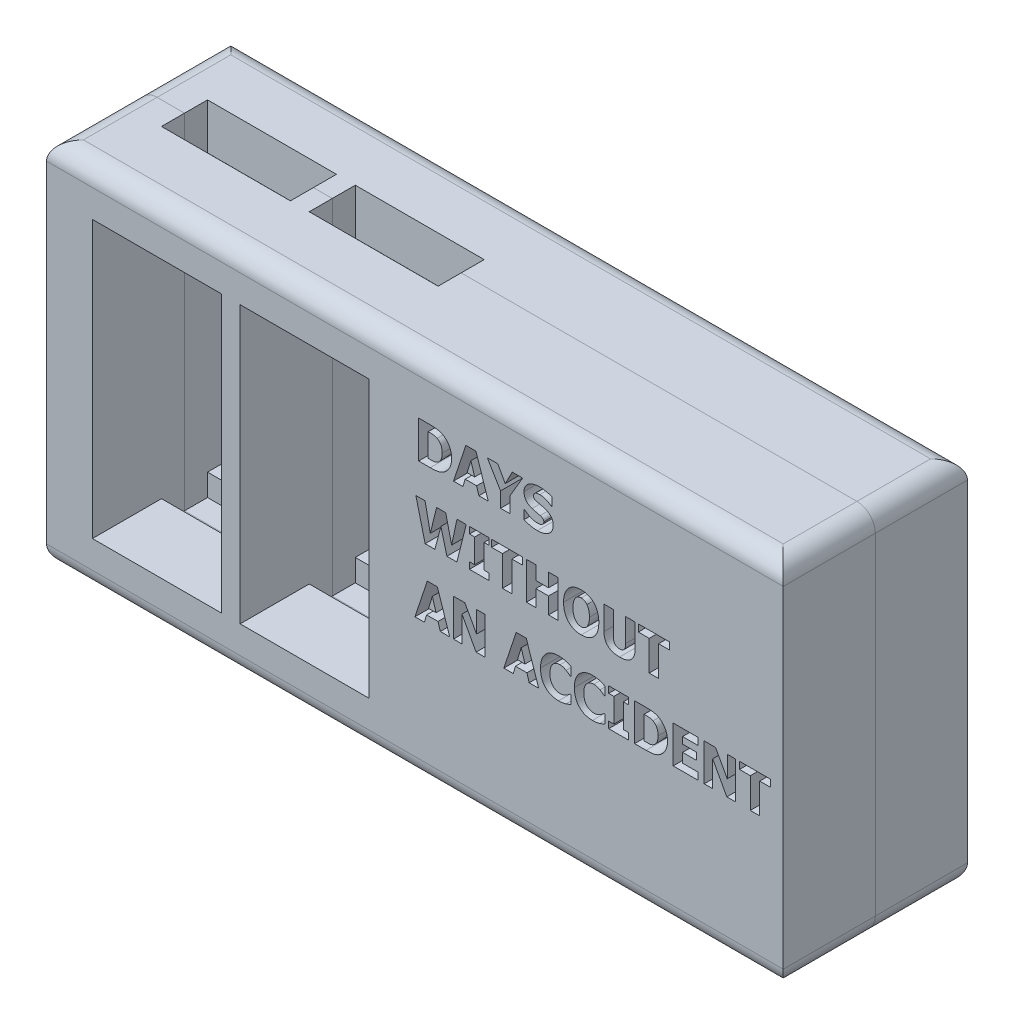
from build123d import *

# Parameters (mm, degrees)
SKETCH1_W           = 101.6
SKETCH1_H           = 25.4
BOSS_EXTRUDE1_DEPTH = 50.8
SKETCH2_W           = 17.78
SKETCH2_H           = 38.122311146
CUT_EXTRUDE1_DEPTH  = 20.32
CUT_EXTRUDE2_DEPTH  = 10.16
SKETCH6_W           = 17.78
SKETCH6_H           = 6.35
CUT_EXTRUDE3_DEPTH  = 47.498
FILLET2_R           = 2.54


with BuildPart() as part:
    # Sketch1 → Boss-Extrude1 (new body)
    with BuildSketch(Plane(origin=(0, 0, 0), x_dir=(1, 0, 0), z_dir=(0, 1, 0))):
        with Locations((50.8, 12.7)):
            Rectangle(SKETCH1_W, SKETCH1_H)
    extrude(amount=BOSS_EXTRUDE1_DEPTH)

    # Sketch2 → Cut-Extrude1 (cut)
    with BuildSketch(Plane.XY):
        with Locations((35.588800345, 25.4)):
            Rectangle(SKETCH2_W, SKETCH2_H)
        with Locations((15.211199655, 25.4)):
            Rectangle(SKETCH2_W, SKETCH2_H)
    extrude(amount=-CUT_EXTRUDE1_DEPTH, mode=Mode.SUBTRACT)

    # Sketch5 → Cut-Extrude2 (cut)
    # profile 1 of 21: a face of its own
    with BuildSketch(Plane.XY):
        with BuildLine():
            add(Edge.make_bspline(
                [(55.860391738, 40.657565776), (55.859345725, 40.598744109), (55.85727471, 40.482282241), (55.842973138, 40.309949524), (55.818894263, 40.142299693), (55.783895751, 39.979636733), (55.740907787, 39.821218318), (55.686432048, 39.667830503), (55.624156845, 39.518382251), (55.550663548, 39.375163668), (55.471388434, 39.237950049), (55.385518889, 39.108714701), (55.295867335, 38.987018748), (55.200186799, 38.873735884), (55.098575435, 38.769831048), (54.993298449, 38.672469793), (54.881272957, 38.585510259), (54.803392021, 38.532773851), (54.764581748, 38.506493807)],
                knots=[0, 0, 0, 0, 1.121822389, 2.221112362, 3.295660391, 4.349819622, 5.392669781, 6.424006338, 7.452176772, 8.478224285, 9.491830202, 10.473124269, 11.435960549, 12.37335562, 13.298531032, 14.206304325, 15.106150719, 16, 16, 16, 16], degree=3))
            add(Edge.make_bspline(
                [(54.764581748, 38.506493807), (54.697836119, 38.465744741), (54.565315216, 38.384839023), (54.352106167, 38.29118759), (54.131329397, 38.21795702), (53.900615274, 38.170871691), (53.663204821, 38.140160661), (53.418806585, 38.116040228), (53.167123373, 38.103450534), (52.996700184, 38.101158826), (52.910523958, 38.1)],
                knots=[0, 0, 0, 0, 0.973457821, 1.932763407, 2.894071884, 3.866837462, 4.861230705, 5.876345917, 6.926152624, 8, 8, 8, 8], degree=3))
            Line((52.910523958, 38.1), (51.319014537, 38.1))
            Line((51.319014537, 38.1), (51.319014537, 43.225268555))
            Line((51.319014537, 43.225268555), (52.896332154, 43.225268555))
            add(Edge.make_bspline(
                [(52.896332154, 43.225268555), (52.984203961, 43.224603014), (53.157346989, 43.22329163), (53.412606964, 43.209561145), (53.65945997, 43.188408476), (53.898526801, 43.159454963), (54.131155329, 43.114021252), (54.3557594, 43.042872359), (54.572733959, 42.945836663), (54.708925914, 42.864127083), (54.777759851, 42.822829548)],
                knots=[0, 0, 0, 0, 1.079902021, 2.127844083, 3.140779136, 4.124649306, 5.086536717, 6.049284413, 7.014072209, 8, 8, 8, 8], degree=3))
            add(Edge.make_bspline(
                [(54.777759851, 42.822829548), (54.818679442, 42.795304384), (54.900332719, 42.740379108), (55.016223353, 42.648609443), (55.12524214, 42.549370197), (55.228273075, 42.443778008), (55.323582335, 42.330581984), (55.413129029, 42.211089199), (55.495077188, 42.083703206), (55.571264007, 41.950384136), (55.63931854, 41.809846098), (55.699147932, 41.663430595), (55.749072639, 41.51024112), (55.78885061, 41.351206312), (55.822219248, 41.186639839), (55.843439916, 41.01548699), (55.858719069, 40.838620107), (55.859829513, 40.718422582), (55.860391738, 40.657565776)],
                knots=[0, 0, 0, 0, 0.935560749, 1.86687108, 2.801970286, 3.731535202, 4.664191023, 5.608042752, 6.563109811, 7.536574956, 8.520207772, 9.523969371, 10.535788198, 11.574633174, 12.633450416, 13.71986561, 14.845552802, 16, 16, 16, 16], degree=3))
        make_face()
        with BuildLine():
            add(Edge.make_bspline(
                [(54.562855395, 40.665675378), (54.560667987, 40.746529388), (54.556449326, 40.902465452), (54.525473489, 41.127832683), (54.470795304, 41.334302466), (54.407143679, 41.493253977), (54.346668983, 41.610610732), (54.294013664, 41.691906032), (54.237323327, 41.769813641), (54.173780115, 41.842310289), (54.103995839, 41.909357357), (54.029950581, 41.973032275), (53.948873696, 42.030517657), (53.891354018, 42.064634328), (53.862388509, 42.081814652)],
                knots=[0, 0, 0, 0, 1.750384853, 3.375814294, 4.912618378, 6.363557404, 7.073665802, 7.767764976, 8.458424072, 9.158359342, 9.851648351, 10.552347909, 11.270997694, 12, 12, 12, 12], degree=3))
            add(Edge.make_bspline(
                [(53.862388509, 42.081814652), (53.819323205, 42.104309224), (53.73404201, 42.148854687), (53.598045149, 42.193987896), (53.460140384, 42.227388187), (53.31653873, 42.239336524), (53.165667085, 42.243985539), (53.002809827, 42.250069027), (52.826049857, 42.251158838), (52.703390485, 42.25178962), (52.639865986, 42.252116297)],
                knots=[0, 0, 0, 0, 0.931672598, 1.844969007, 2.743879701, 3.650511313, 4.605290892, 5.644149072, 6.779919967, 8, 8, 8, 8], degree=3))
            Line((52.639865986, 42.252116297), (52.61655088, 42.252116297))
            Line((52.61655088, 42.252116297), (52.61655088, 39.073152257))
            Line((52.61655088, 39.073152257), (52.639865986, 39.073152257))
            add(Edge.make_bspline(
                [(52.639865986, 39.073152257), (52.708461841, 39.07330186), (52.840254344, 39.07358929), (53.029472883, 39.076996383), (53.201855467, 39.080659675), (53.359921667, 39.086538185), (53.509144073, 39.101759001), (53.651939032, 39.139654255), (53.791803694, 39.194053068), (53.878883468, 39.244926974), (53.923210526, 39.270823809)],
                knots=[0, 0, 0, 0, 1.248445623, 2.398625619, 3.444398636, 4.386318194, 5.278054247, 6.167050445, 7.066956017, 8, 8, 8, 8], degree=3))
            add(Edge.make_bspline(
                [(53.923210526, 39.270823809), (53.973322451, 39.305573418), (54.072987657, 39.37468525), (54.202806101, 39.50356559), (54.312802424, 39.651256875), (54.40514012, 39.816910269), (54.475762707, 40.002811475), (54.52703119, 40.206859625), (54.557611437, 40.430253304), (54.561061843, 40.58515572), (54.562855395, 40.665675378)],
                knots=[0, 0, 0, 0, 0.910460996, 1.810772236, 2.720195286, 3.656503622, 4.636985059, 5.684687075, 6.796479684, 8, 8, 8, 8], degree=3))
        make_face(mode=Mode.SUBTRACT)
    # profile 2 of 21: a face of its own
    with BuildSketch(Plane.XY):
        Polygon((56.119899006, 38.1), (57.827983958, 43.225268555), (59.212698524, 43.225268555), (60.920783475, 38.1), (59.621219732, 38.1), (59.306972649, 39.138029074), (57.732696132, 39.138029074), (57.418449049, 38.1), align=None)
        Polygon((59.038342078, 40.046304514), (58.520341241, 41.742225063), (58.001326703, 40.046304514), align=None, mode=Mode.SUBTRACT)
    # profile 3 of 21: a face of its own
    with BuildSketch(Plane.XY):
        Polygon((65.656791127, 43.225268555), (63.905117064, 40.240934966), (63.905117064, 38.1), (62.607580721, 38.1), (62.607580721, 40.176058149), (60.791029841, 43.225268555), (62.22541572, 43.225268555), (63.254321492, 41.370197064), (64.227473749, 43.225268555), align=None)
    # profile 4 of 21: a face of its own
    with BuildSketch(Plane.XY):
        with BuildLine():
            add(Edge.make_bspline(
                [(67.684191663, 37.970246366), (67.59054776, 37.971502078), (67.409085814, 37.973935381), (67.14540111, 37.995696111), (66.89903776, 38.030111778), (66.668797548, 38.080798934), (66.452167685, 38.142459728), (66.244597442, 38.211183875), (66.043987762, 38.283707112), (65.915011853, 38.339907724), (65.851421578, 38.367616871)],
                knots=[0, 0, 0, 0, 1.188587951, 2.303230391, 3.356350567, 4.344124042, 5.293358606, 6.214416522, 7.119636025, 8, 8, 8, 8], degree=3))
            Line((65.851421578, 38.367616871), (65.851421578, 39.592166794))
            Line((65.851421578, 39.592166794), (65.966983409, 39.592166794))
            add(Edge.make_bspline(
                [(65.966983409, 39.592166794), (66.030896075, 39.536884364), (66.157448673, 39.427420376), (66.363116152, 39.285530078), (66.577127839, 39.162124289), (66.799689594, 39.060502134), (67.02469621, 38.979142217), (67.249333672, 38.922988044), (67.469995479, 38.884560651), (67.616794402, 38.880517611), (67.689260164, 38.878521806)],
                knots=[0, 0, 0, 0, 1.064005933, 2.106823643, 3.142324773, 4.172904671, 5.185521809, 6.151983196, 7.087745727, 8, 8, 8, 8], degree=3))
            add(Edge.make_bspline(
                [(67.689260164, 38.878521806), (67.70886662, 38.879028328), (67.750834511, 38.880112545), (67.818101991, 38.885594644), (67.893799737, 38.893797557), (67.975756451, 38.904283271), (68.057717935, 38.918781274), (68.134070195, 38.936687799), (68.201638954, 38.958310733), (68.241906926, 38.977768197), (68.260987115, 38.986987734)],
                knots=[0, 0, 0, 0, 0.803171281, 1.719199296, 2.763054104, 3.921781135, 5.102693432, 6.170135007, 7.132954358, 8, 8, 8, 8], degree=3))
            add(Edge.make_bspline(
                [(68.260987115, 38.986987734), (68.282541357, 38.998354748), (68.325338429, 39.020924546), (68.384402068, 39.062646056), (68.437264423, 39.111393454), (68.487038985, 39.164176328), (68.52690821, 39.227285846), (68.557126391, 39.298934921), (68.572502157, 39.380682193), (68.574962395, 39.437692898), (68.576247899, 39.467481661)],
                knots=[0, 0, 0, 0, 0.958250464, 1.902656275, 2.834625234, 3.785374419, 4.748042504, 5.755488648, 6.827216455, 8, 8, 8, 8], degree=3))
            add(Edge.make_bspline(
                [(68.576247899, 39.467481661), (68.57468767, 39.498794905), (68.571648963, 39.559780681), (68.542166648, 39.64635747), (68.492519062, 39.722296965), (68.425839409, 39.787849628), (68.346308734, 39.84255387), (68.261128571, 39.894150953), (68.166132506, 39.932528682), (68.099959438, 39.952857892), (68.066356664, 39.963181092)],
                knots=[0, 0, 0, 0, 0.976980105, 1.90276968, 2.820378867, 3.79191295, 4.806747273, 5.83454199, 6.900377446, 8, 8, 8, 8], degree=3))
            add(Edge.make_bspline(
                [(68.066356664, 39.963181092), (67.9766104, 39.986403836), (67.791936009, 40.034190183), (67.509677135, 40.095331473), (67.227626297, 40.160432706), (67.045866269, 40.220028022), (66.957368571, 40.249044568)],
                knots=[0, 0, 0, 0, 0.970778871, 1.997609583, 3.025049981, 4, 4, 4, 4], degree=3))
            add(Edge.make_bspline(
                [(66.957368571, 40.249044568), (66.909502053, 40.267083309), (66.816484266, 40.302137534), (66.683870133, 40.362567126), (66.56162407, 40.426592963), (66.449979234, 40.496302196), (66.348720845, 40.569797932), (66.257563153, 40.648231795), (66.177497314, 40.731643396), (66.1061999, 40.819174783), (66.046992461, 40.913703141), (65.99346106, 41.011680152), (65.950063995, 41.116603183), (65.913214393, 41.22649693), (65.88656478, 41.342770892), (65.86592807, 41.463870827), (65.853652266, 41.590930929), (65.852175663, 41.67765965), (65.851421578, 41.721951057)],
                knots=[0, 0, 0, 0, 1.232734205, 2.395541005, 3.510463934, 4.556875624, 5.565319495, 6.523880384, 7.451310254, 8.349375782, 9.239576409, 10.136015274, 11.0376197, 11.972601359, 12.926826808, 13.909683999, 14.932498543, 16, 16, 16, 16], degree=3))
            add(Edge.make_bspline(
                [(65.851421578, 41.721951057), (65.853034471, 41.781200126), (65.856205948, 41.89770328), (65.885441389, 42.068264485), (65.933147203, 42.230191041), (65.999284318, 42.383744733), (66.085592239, 42.527880382), (66.190658796, 42.663079042), (66.314632882, 42.789689441), (66.456217232, 42.905990789), (66.611187539, 43.012296493), (66.778360182, 43.102866419), (66.953516353, 43.181872005), (67.138386421, 43.245771932), (67.333288162, 43.29400136), (67.536842876, 43.32933193), (67.749944571, 43.351175438), (67.894988544, 43.353722019), (67.969041438, 43.355022189)],
                knots=[0, 0, 0, 0, 0.951733787, 1.8714216, 2.771937187, 3.659834458, 4.551246461, 5.464900409, 6.405895824, 7.393377429, 8.405714223, 9.421759516, 10.445282372, 11.49132611, 12.560961497, 13.669079994, 14.809937645, 16, 16, 16, 16], degree=3))
            add(Edge.make_bspline(
                [(67.969041438, 43.355022189), (68.044763799, 43.353779291), (68.196399049, 43.351290368), (68.423057715, 43.333416424), (68.649160313, 43.305407159), (68.872214656, 43.264530366), (69.089811929, 43.215592729), (69.297563088, 43.157876457), (69.493901125, 43.092823133), (69.618285013, 43.040860936), (69.67915379, 43.015432599)],
                knots=[0, 0, 0, 0, 1.035526462, 2.073658467, 3.107699001, 4.15013179, 5.173679131, 6.156969703, 7.09809057, 8, 8, 8, 8], degree=3))
            Line((69.67915379, 43.015432599), (69.67915379, 41.862855395))
            Line((69.67915379, 41.862855395), (69.56561936, 41.862855395))
            add(Edge.make_bspline(
                [(69.56561936, 41.862855395), (69.516310568, 41.903000296), (69.415653887, 41.984950236), (69.248074109, 42.092305806), (69.066191102, 42.192301178), (68.870636484, 42.280013553), (68.666350798, 42.355093539), (68.455877881, 42.406827649), (68.242878274, 42.44153774), (68.099606988, 42.445008228), (68.027836054, 42.446746749)],
                knots=[0, 0, 0, 0, 0.909132475, 1.855860894, 2.842486714, 3.876811078, 4.919788485, 5.951669293, 6.973900401, 8, 8, 8, 8], degree=3))
            add(Edge.make_bspline(
                [(68.027836054, 42.446746749), (67.974718277, 42.445834927), (67.873453636, 42.444096614), (67.725854114, 42.423685645), (67.582629705, 42.383844296), (67.491732574, 42.342021799), (67.443944699, 42.320034215)],
                knots=[0, 0, 0, 0, 1.055808145, 2.01281076, 2.955263502, 4, 4, 4, 4], degree=3))
            add(Edge.make_bspline(
                [(67.443944699, 42.320034215), (67.424379206, 42.309369511), (67.385088755, 42.287953182), (67.330835715, 42.246353207), (67.280581218, 42.198007), (67.234904188, 42.143307491), (67.195911453, 42.083755596), (67.169997699, 42.018065162), (67.151184975, 41.950070559), (67.149704012, 41.902859134), (67.148957921, 41.879074599)],
                knots=[0, 0, 0, 0, 0.957416142, 1.922635494, 2.930164298, 3.951958416, 4.984347753, 5.975062963, 6.979861616, 8, 8, 8, 8], degree=3))
            add(Edge.make_bspline(
                [(67.148957921, 41.879074599), (67.150742683, 41.847483129), (67.154183248, 41.78658284), (67.179836876, 41.699770186), (67.22489127, 41.624119256), (67.276252711, 41.569859668), (67.327857434, 41.532601693), (67.374519585, 41.504260071), (67.429762588, 41.476749222), (67.493308005, 41.451517756), (67.563853034, 41.424233884), (67.64286109, 41.399424717), (67.730208433, 41.37524205), (67.791270746, 41.359926136), (67.823068599, 41.35195046)],
                knots=[0, 0, 0, 0, 1.214264784, 2.34079248, 3.441844924, 4.572488008, 5.185916398, 5.885766898, 6.670379076, 7.556104553, 8.514370256, 9.57884454, 10.739196989, 12, 12, 12, 12], degree=3))
            add(Edge.make_bspline(
                [(67.823068599, 41.35195046), (67.907238189, 41.332818851), (68.072368717, 41.295284955), (68.319821497, 41.236679411), (68.572082213, 41.171984994), (68.739508807, 41.113666719), (68.826631865, 41.083319889)],
                knots=[0, 0, 0, 0, 0.996266869, 1.954554799, 2.935620461, 4, 4, 4, 4], degree=3))
            add(Edge.make_bspline(
                [(68.826631865, 41.083319889), (68.869801356, 41.067030874), (68.954147799, 41.035204683), (69.07352396, 40.978361206), (69.18579671, 40.92050992), (69.288325083, 40.85605421), (69.38292145, 40.788167084), (69.46941588, 40.716436717), (69.546737415, 40.639845242), (69.616681211, 40.559397958), (69.6775869, 40.472696075), (69.730803427, 40.380314097), (69.774191795, 40.280734381), (69.810992827, 40.175126242), (69.839058691, 40.062437109), (69.85925688, 39.943163708), (69.871569402, 39.817467636), (69.873035441, 39.731409879), (69.873784241, 39.68745462)],
                knots=[0, 0, 0, 0, 1.17454689, 2.294881178, 3.365011102, 4.38938974, 5.375760562, 6.328835541, 7.247690706, 8.144686596, 9.040029798, 9.941965584, 10.855040075, 11.802113214, 12.787244475, 13.808691087, 14.880756899, 16, 16, 16, 16], degree=3))
            add(Edge.make_bspline(
                [(69.873784241, 39.68745462), (69.872086765, 39.624506547), (69.868757172, 39.50103416), (69.840935545, 39.32036329), (69.79434322, 39.149277431), (69.728949697, 38.987646423), (69.645114373, 38.835655959), (69.543312277, 38.692578244), (69.421232531, 38.56048742), (69.282600174, 38.438300027), (69.128740862, 38.327703998), (68.960234773, 38.232266155), (68.779177827, 38.15133424), (68.585356544, 38.083867415), (68.3782859, 38.032670861), (68.158258493, 37.996787461), (67.925605133, 37.973756341), (67.766020071, 37.971436091), (67.684191663, 37.970246366)],
                knots=[0, 0, 0, 0, 0.965575501, 1.893972421, 2.797150248, 3.681070906, 4.56293602, 5.455031491, 6.368877871, 7.316649527, 8.286503653, 9.271159268, 10.283057314, 11.32599161, 12.416327018, 13.55177918, 14.744656859, 16, 16, 16, 16], degree=3))
        make_face()
    # profile 5 of 21: a face of its own
    with BuildSketch(Plane.XY):
        Polygon((57.871573069, 33.791282325), (56.592283331, 28.666013771), (55.210609866, 28.666013771), (54.388498948, 31.835854509), (53.554223628, 28.666013771), (52.209043372, 28.666013771), (50.929753634, 33.791282325), (52.20093377, 33.791282325), (52.91964726, 30.260564292), (53.791429491, 33.791282325), (55.050445223, 33.791282325), (55.861405438, 30.324427409), (56.600392933, 33.791282325), align=None)
    # profile 6 of 21: a face of its own
    with BuildSketch(Plane.XY):
        Polygon((61.050537109, 28.666013771), (58.325710789, 28.666013771), (58.325710789, 29.574289211), (59.039355778, 29.574289211), (59.039355778, 32.883006885), (58.325710789, 32.883006885), (58.325710789, 33.791282325), (61.050537109, 33.791282325), (61.050537109, 32.883006885), (60.336892121, 32.883006885), (60.336892121, 29.574289211), (61.050537109, 29.574289211), align=None)
    # profile 7 of 21: a face of its own
    with BuildSketch(Plane.XY):
        Polygon((62.86708799, 28.666013771), (62.86708799, 32.818130068), (61.374921195, 32.818130068), (61.374921195, 33.791282325), (65.656791127, 33.791282325), (65.656791127, 32.818130068), (64.164624332, 32.818130068), (64.164624332, 28.666013771), align=None)
    # profile 8 of 21: a face of its own
    with BuildSketch(Plane.XY):
        Polygon((70.522552413, 28.666013771), (69.22501607, 28.666013771), (69.22501607, 30.936702371), (67.473342007, 30.936702371), (67.473342007, 28.666013771), (66.175805664, 28.666013771), (66.175805664, 33.791282325), (67.473342007, 33.791282325), (67.473342007, 31.909854628), (69.22501607, 31.909854628), (69.22501607, 33.791282325), (70.522552413, 33.791282325), align=None)
    # profile 9 of 21: a face of its own
    with BuildSketch(Plane.XY):
        with BuildLine():
            add(Edge.make_bspline(
                [(76.166835505, 31.226620648), (76.165002478, 31.124832695), (76.161431286, 30.926524522), (76.13041728, 30.637409597), (76.080344608, 30.365060208), (76.009762219, 30.108841718), (75.916787832, 29.869916096), (75.805797542, 29.646165518), (75.671946454, 29.440773417), (75.519811686, 29.252494514), (75.349557709, 29.084057785), (75.163054107, 28.937376229), (74.961682446, 28.812404167), (74.744924412, 28.710861452), (74.512441368, 28.63283197), (74.265700227, 28.576164904), (74.003525586, 28.542316156), (73.823937473, 28.53831175), (73.731927461, 28.536260136)],
                knots=[0, 0, 0, 0, 1.189079844, 2.316622391, 3.39301205, 4.421840737, 5.416816174, 6.384428204, 7.335006513, 8.275362366, 9.207852477, 10.127253029, 11.042132357, 11.971180715, 12.917592702, 13.902165424, 14.925197332, 16, 16, 16, 16], degree=3))
            add(Edge.make_bspline(
                [(73.731927461, 28.536260136), (73.639560724, 28.538170012), (73.459554164, 28.541892023), (73.197252304, 28.577588402), (72.950196958, 28.633511864), (72.717879222, 28.712983998), (72.501125652, 28.815473451), (72.299494461, 28.941453071), (72.11323051, 29.089903645), (71.944144116, 29.261091986), (71.7917681, 29.450128697), (71.660825326, 29.657845294), (71.548629839, 29.880249733), (71.458752073, 30.119465106), (71.387498611, 30.373783684), (71.337608252, 30.644181618), (71.306487533, 30.930228502), (71.30290864, 31.126181616), (71.301074219, 31.226620648)],
                knots=[0, 0, 0, 0, 1.080317887, 2.105349957, 3.091355781, 4.040422853, 4.97251073, 5.890809664, 6.816459549, 7.753090285, 8.700970549, 9.651987685, 10.62100813, 11.610906846, 12.637424941, 13.707608467, 14.824996543, 16, 16, 16, 16], degree=3))
            add(Edge.make_bspline(
                [(71.301074219, 31.226620648), (71.302930239, 31.327732555), (71.306557986, 31.525364241), (71.337434866, 31.813465544), (71.387509327, 32.085529422), (71.458770057, 32.340850554), (71.548449335, 32.580820279), (71.660530083, 32.803365018), (71.792138644, 33.010297737), (71.943810522, 33.199212943), (72.113269013, 33.369474348), (72.299799469, 33.51679156), (72.501086496, 33.642905616), (72.717908564, 33.745225473), (72.950045569, 33.825115823), (73.197411166, 33.879351774), (73.459531429, 33.915502971), (73.639553014, 33.919159623), (73.731927461, 33.92103596)],
                knots=[0, 0, 0, 0, 1.181311189, 2.308971597, 3.381592327, 4.410528555, 5.402783556, 6.37049673, 7.316900563, 8.263502075, 9.196072939, 10.118016634, 11.035076724, 11.965907153, 12.913693872, 13.897490296, 14.921139532, 16, 16, 16, 16], degree=3))
            add(Edge.make_bspline(
                [(73.731927461, 33.92103596), (73.823940511, 33.918993201), (74.003534554, 33.915006079), (74.265666887, 33.881034025), (74.512666011, 33.824783821), (74.744710835, 33.745137185), (74.961721086, 33.643973859), (75.163011622, 33.518845997), (75.349878319, 33.372224595), (75.519827533, 33.202716762), (75.671665203, 33.013602064), (75.805835309, 32.808116907), (75.916776911, 32.584331229), (76.009766913, 32.345415594), (76.080336854, 32.08919349), (76.130506032, 31.816517528), (76.16137807, 31.527048183), (76.164986498, 31.328407006), (76.166835505, 31.226620648)],
                knots=[0, 0, 0, 0, 1.074060791, 2.096386557, 3.080279682, 4.027313204, 4.955720291, 5.869968128, 6.788734069, 7.723357901, 8.666132665, 9.616054842, 10.582998983, 11.577287643, 12.605406185, 13.681052873, 14.811740912, 16, 16, 16, 16], degree=3))
        make_face()
        with BuildLine():
            add(Edge.make_bspline(
                [(74.869299162, 31.230675449), (74.868137017, 31.305047234), (74.865904439, 31.447921768), (74.848832587, 31.653869983), (74.819976427, 31.842297385), (74.779470679, 32.014158777), (74.728266019, 32.169627693), (74.670778328, 32.31122873), (74.605960029, 32.43913669), (74.553203158, 32.514884237), (74.527682172, 32.551526898)],
                knots=[0, 0, 0, 0, 1.287174704, 2.472772232, 3.57375833, 4.583793058, 5.525202796, 6.403859325, 7.227871477, 8, 8, 8, 8], degree=3))
            add(Edge.make_bspline(
                [(74.527682172, 32.551526898), (74.500261902, 32.584844931), (74.447015543, 32.64954393), (74.358605903, 32.735387442), (74.262365121, 32.803075665), (74.162298296, 32.857520178), (74.058533145, 32.897941973), (73.952724414, 32.926111931), (73.84506961, 32.944291101), (73.772547454, 32.946679492), (73.735982262, 32.947883703)],
                knots=[0, 0, 0, 0, 1.126585517, 2.187672819, 3.206336016, 4.189521334, 5.156373335, 6.106816172, 7.045469219, 8, 8, 8, 8], degree=3))
            add(Edge.make_bspline(
                [(73.735982262, 32.947883703), (73.697731047, 32.947066467), (73.622892751, 32.94546755), (73.513618443, 32.928326881), (73.409667419, 32.902624737), (73.310607309, 32.864216568), (73.214370995, 32.813496637), (73.123076149, 32.743106362), (73.030893737, 32.659660324), (72.975907572, 32.593181358), (72.947323454, 32.5586228)],
                knots=[0, 0, 0, 0, 1.002961705, 1.962289189, 2.895653215, 3.80792997, 4.744195718, 5.739089679, 6.824683862, 8, 8, 8, 8], degree=3))
            add(Edge.make_bspline(
                [(72.947323454, 32.5586228), (72.921821643, 32.522651536), (72.868839526, 32.447918269), (72.803016372, 32.32071234), (72.74276523, 32.178216665), (72.69203674, 32.018986785), (72.648292736, 31.843935367), (72.620697785, 31.652055169), (72.601624842, 31.444613939), (72.59963914, 31.301007649), (72.598610562, 31.226620648)],
                knots=[0, 0, 0, 0, 0.755164283, 1.568916089, 2.449019537, 3.40530965, 4.430988336, 5.538686369, 6.72505765, 8, 8, 8, 8], degree=3))
            add(Edge.make_bspline(
                [(72.598610562, 31.226620648), (72.599741332, 31.150556407), (72.601905529, 31.00497602), (72.619142636, 30.796742922), (72.646651004, 30.60855012), (72.686413541, 30.439434105), (72.736312717, 30.286917144), (72.795587525, 30.148547695), (72.86141501, 30.021783126), (72.914412433, 29.94581465), (72.940227552, 29.908810299)],
                knots=[0, 0, 0, 0, 1.318170318, 2.522864159, 3.618647017, 4.611587825, 5.530173897, 6.396057923, 7.218717585, 8, 8, 8, 8], degree=3))
            add(Edge.make_bspline(
                [(72.940227552, 29.908810299), (72.967584267, 29.875090175), (73.02085561, 29.809427456), (73.110314522, 29.723392931), (73.206386746, 29.653788129), (73.307724369, 29.599836877), (73.412132383, 29.55952316), (73.518537443, 29.531031869), (73.626572505, 29.513088106), (73.699420857, 29.510640705), (73.735982262, 29.509412394)],
                knots=[0, 0, 0, 0, 1.126399206, 2.193421182, 3.21099292, 4.195910863, 5.165042014, 6.109693258, 7.051285721, 8, 8, 8, 8], degree=3))
            add(Edge.make_bspline(
                [(73.735982262, 29.509412394), (73.772877878, 29.510617432), (73.846778855, 29.513031093), (73.95683787, 29.531560815), (74.064457425, 29.563869129), (74.170706721, 29.605686737), (74.271840446, 29.662734719), (74.367050937, 29.732967223), (74.453880906, 29.818278053), (74.504724101, 29.882874281), (74.530723272, 29.915906201)],
                knots=[0, 0, 0, 0, 0.954659109, 1.912157864, 2.877967119, 3.858822935, 4.861119912, 5.873816251, 6.912754912, 8, 8, 8, 8], degree=3))
            add(Edge.make_bspline(
                [(74.530723272, 29.915906201), (74.556764806, 29.954673041), (74.609709803, 30.033489836), (74.676944635, 30.16126315), (74.735012893, 30.298308357), (74.784619147, 30.446467071), (74.82364804, 30.611551239), (74.849505896, 30.79749973), (74.867455615, 31.006298373), (74.86866303, 31.153252123), (74.869299162, 31.230675449)],
                knots=[0, 0, 0, 0, 0.811098523, 1.649043018, 2.504094341, 3.39537459, 4.360999606, 5.44717599, 6.655031781, 8, 8, 8, 8], degree=3))
        make_face(mode=Mode.SUBTRACT)
    # profile 10 of 21: a face of its own
    with BuildSketch(Plane.XY):
        with BuildLine():
            add(Edge.make_bspline(
                [(79.019388059, 28.536260136), (78.935864713, 28.537780283), (78.773547029, 28.540734508), (78.537798069, 28.564596702), (78.316356432, 28.601884495), (78.110510821, 28.65837344), (77.91836874, 28.727432613), (77.742030574, 28.814479164), (77.579558671, 28.915746503), (77.432930871, 29.033907069), (77.302543786, 29.167243039), (77.188868701, 29.315454805), (77.093741919, 29.478573374), (77.014939053, 29.655583155), (76.954387465, 29.847430994), (76.911108941, 30.053501133), (76.885850343, 30.274129709), (76.882306604, 30.425731172), (76.880480493, 30.503852357)],
                knots=[0, 0, 0, 0, 1.20889921, 2.349351777, 3.427017415, 4.455847307, 5.435483287, 6.378388974, 7.297220547, 8.201760428, 9.097701332, 9.990980776, 10.898742395, 11.825056972, 12.790409071, 13.805470659, 14.869145272, 16, 16, 16, 16], degree=3))
            Line((76.880480493, 30.503852357), (76.880480493, 33.791282325))
            Line((76.880480493, 33.791282325), (78.178016836, 33.791282325))
            Line((78.178016836, 33.791282325), (78.178016836, 30.572783975))
            add(Edge.make_bspline(
                [(78.178016836, 30.572783975), (78.178546713, 30.529512177), (78.179574606, 30.445570302), (78.18901724, 30.323776174), (78.203131246, 30.210417546), (78.226533098, 30.106128612), (78.252505387, 30.009535964), (78.287892444, 29.922206725), (78.326573011, 29.84216626), (78.373948212, 29.771543157), (78.42760669, 29.708987792), (78.48983486, 29.655686826), (78.558619267, 29.609670696), (78.636152809, 29.573404493), (78.720481472, 29.543438991), (78.813551957, 29.523909088), (78.913963564, 29.511532242), (78.983530963, 29.510133399), (79.019388059, 29.509412394)],
                knots=[0, 0, 0, 0, 1.331165497, 2.582294552, 3.757141455, 4.84200943, 5.868829169, 6.830301252, 7.736977925, 8.599166662, 9.439321676, 10.264810001, 11.11258577, 11.97752831, 12.891625934, 13.860322391, 14.897146833, 16, 16, 16, 16], degree=3))
            add(Edge.make_bspline(
                [(79.019388059, 29.509412394), (79.054572106, 29.510111475), (79.122797776, 29.511467068), (79.221422375, 29.524156056), (79.313238803, 29.542869526), (79.397745097, 29.570035232), (79.474676694, 29.605837606), (79.544325668, 29.649630659), (79.606312024, 29.701830558), (79.662170059, 29.761225916), (79.710133044, 29.830416539), (79.751462537, 29.908872411), (79.786793908, 29.996571555), (79.816362624, 30.093476893), (79.83836289, 30.20005551), (79.852628015, 30.316029714), (79.863640159, 30.441133692), (79.864413101, 30.527815725), (79.864814082, 30.572783975)],
                knots=[0, 0, 0, 0, 1.079206003, 2.092697049, 3.046504859, 3.951550563, 4.809764005, 5.644026712, 6.468501297, 7.290232633, 8.138870875, 9.04344124, 10.006225207, 11.036185737, 12.148605823, 13.340896587, 14.620530438, 16, 16, 16, 16], degree=3))
            Line((79.864814082, 30.572783975), (79.864814082, 33.791282325))
            Line((79.864814082, 33.791282325), (81.162350425, 33.791282325))
            Line((81.162350425, 33.791282325), (81.162350425, 30.506893457))
            add(Edge.make_bspline(
                [(81.162350425, 30.506893457), (81.160953033, 30.42978216), (81.158235945, 30.279847081), (81.13263341, 30.061998597), (81.089954822, 29.858194221), (81.031878389, 29.667055276), (80.954320372, 29.490765576), (80.861817188, 29.32704651), (80.750194288, 29.178748897), (80.623292798, 29.043156659), (80.479374039, 28.922356313), (80.317869887, 28.819435232), (80.141714395, 28.730207383), (79.948131779, 28.659759952), (79.738726567, 28.604414013), (79.513365356, 28.563878706), (79.271604413, 28.540878772), (79.105263862, 28.537832711), (79.019388059, 28.536260136)],
                knots=[0, 0, 0, 0, 1.112985887, 2.164087931, 3.161073054, 4.116228462, 5.042529852, 5.936270584, 6.825138138, 7.715570683, 8.612541069, 9.530013209, 10.474708362, 11.457956063, 12.498132776, 13.598602899, 14.760242755, 16, 16, 16, 16], degree=3))
        make_face()
    # profile 11 of 21: a face of its own
    with BuildSketch(Plane.XY):
        Polygon((83.10865494, 28.666013771), (83.10865494, 32.818130068), (81.616488145, 32.818130068), (81.616488145, 33.791282325), (85.898358077, 33.791282325), (85.898358077, 32.818130068), (84.406191283, 32.818130068), (84.406191283, 28.666013771), align=None)
    # profile 12 of 21: a face of its own
    with BuildSketch(Plane.XY):
        Polygon((50.8, 19.232027542), (52.508084951, 24.357296096), (53.892799517, 24.357296096), (55.600884469, 19.232027542), (54.301320725, 19.232027542), (53.987073642, 20.270056616), (52.412797126, 20.270056616), (52.098550043, 19.232027542), align=None)
        Polygon((53.718443071, 21.178332056), (53.200442234, 22.874252604), (52.681427697, 21.178332056), align=None, mode=Mode.SUBTRACT)
    # profile 13 of 21: a face of its own
    with BuildSketch(Plane.XY):
        Polygon((60.466645755, 19.232027542), (59.23804103, 19.232027542), (57.287681715, 22.805320986), (57.287681715, 19.232027542), (56.119899006, 19.232027542), (56.119899006, 24.357296096), (57.68505222, 24.357296096), (59.298863046, 21.42162012), (59.298863046, 24.357296096), (60.466645755, 24.357296096), align=None)
    # profile 14 of 21: a face of its own
    with BuildSketch(Plane.XY):
        Polygon((63.061718441, 19.232027542), (64.769803392, 24.357296096), (66.154517958, 24.357296096), (67.86260291, 19.232027542), (66.563039166, 19.232027542), (66.248792083, 20.270056616), (64.674515567, 20.270056616), (64.360268484, 19.232027542), align=None)
        Polygon((65.980161512, 21.178332056), (65.462160675, 22.874252604), (64.943146138, 21.178332056), align=None, mode=Mode.SUBTRACT)
    # profile 15 of 21: a face of its own
    with BuildSketch(Plane.XY):
        with BuildLine():
            add(Edge.make_bspline(
                [(70.613785437, 19.102273907), (70.520774133, 19.104439536), (70.338896698, 19.108674279), (70.073325794, 19.141022298), (69.822887219, 19.196881539), (69.58720108, 19.274187084), (69.365313582, 19.372458715), (69.159033165, 19.494966962), (68.966892979, 19.638606667), (68.791522875, 19.804565235), (68.63300527, 19.989359193), (68.496802165, 20.194658876), (68.379049571, 20.416145508), (68.285780111, 20.65716356), (68.21074444, 20.914738992), (68.160989361, 21.191018891), (68.126846284, 21.484291246), (68.123715796, 21.686090895), (68.122110179, 21.789593318)],
                knots=[0, 0, 0, 0, 1.074819738, 2.101738696, 3.086164081, 4.035861867, 4.9641276, 5.885061211, 6.802809627, 7.73107536, 8.670179168, 9.610346125, 10.572900667, 11.563534563, 12.59188571, 13.668803488, 14.804336451, 16, 16, 16, 16], degree=3))
            add(Edge.make_bspline(
                [(68.122110179, 21.789593318), (68.123765597, 21.889712076), (68.1270018, 22.085435773), (68.160725517, 22.370763236), (68.212442774, 22.640970247), (68.286995547, 22.89528447), (68.380499073, 23.135135297), (68.498367913, 23.358005469), (68.635309264, 23.566215722), (68.793631849, 23.756694338), (68.969765707, 23.927856516), (69.161549096, 24.078085529), (69.367949574, 24.20565859), (69.589891655, 24.308100874), (69.825657327, 24.388618603), (70.076285876, 24.446106447), (70.341789648, 24.481223914), (70.5237938, 24.485079116), (70.616826538, 24.487049731)],
                knots=[0, 0, 0, 0, 1.157890448, 2.263577786, 3.319369359, 4.337575634, 5.325651106, 6.292712604, 7.249085993, 8.204171971, 9.152488504, 10.085498645, 11.017533542, 11.953299998, 12.907761637, 13.894993682, 14.924010797, 16, 16, 16, 16], degree=3))
            add(Edge.make_bspline(
                [(70.616826538, 24.487049731), (70.66616487, 24.486653119), (70.762515327, 24.485878596), (70.903204516, 24.480080196), (71.036081838, 24.468890861), (71.201667278, 24.448412661), (71.399411381, 24.415783422), (71.553032345, 24.37724298), (71.628499405, 24.358309796)],
                knots=[0, 0, 0, 0, 0.868198881, 1.695463873, 2.477132392, 3.213909951, 4.631319466, 6, 6, 6, 6], degree=3))
            add(Edge.make_bspline(
                [(71.628499405, 24.358309796), (71.689632995, 24.339251257), (71.818248549, 24.299155057), (71.9754571, 24.233799298), (72.102060252, 24.178246451), (72.190045925, 24.138983816), (72.268203555, 24.102668684), (72.316510074, 24.07862376), (72.339103293, 24.06737782)],
                knots=[0, 0, 0, 0, 1.498738303, 3.153111991, 3.982188687, 4.736543176, 5.409074417, 6, 6, 6, 6], degree=3))
            Line((72.339103293, 24.06737782), (72.339103293, 22.865129302))
            Line((72.339103293, 22.865129302), (72.208335959, 22.865129302))
            add(Edge.make_bspline(
                [(72.208335959, 22.865129302), (72.173311122, 22.893997486), (72.096296168, 22.957474778), (71.969073103, 23.056639151), (71.821393662, 23.164485754), (71.711196269, 23.230282186), (71.653841912, 23.264527207)],
                knots=[0, 0, 0, 0, 0.795981873, 1.750258162, 2.829078504, 4, 4, 4, 4], degree=3))
            add(Edge.make_bspline(
                [(71.653841912, 23.264527207), (71.59200571, 23.298074215), (71.465123225, 23.366909745), (71.294270954, 23.430708191), (71.15143344, 23.475560236), (71.039462537, 23.496624841), (70.925766868, 23.51219487), (70.84901959, 23.513327944), (70.810443289, 23.513897473)],
                knots=[0, 0, 0, 0, 1.421940968, 2.917698665, 3.681312824, 4.448317243, 5.220061178, 6, 6, 6, 6], degree=3))
            add(Edge.make_bspline(
                [(70.810443289, 23.513897473), (70.764760748, 23.513161279), (70.675078751, 23.511716013), (70.543939017, 23.493328805), (70.418099804, 23.466615597), (70.297627944, 23.426867282), (70.181462672, 23.373521074), (70.06882333, 23.304588218), (69.958970217, 23.219226841), (69.891345164, 23.152085579), (69.856551337, 23.117540669)],
                knots=[0, 0, 0, 0, 1.028860978, 2.019815538, 2.978883687, 3.925380634, 4.872735138, 5.853659149, 6.895684257, 8, 8, 8, 8], degree=3))
            add(Edge.make_bspline(
                [(69.856551337, 23.117540669), (69.824867247, 23.082470045), (69.759656502, 23.010289292), (69.676882791, 22.883519124), (69.603524192, 22.73969127), (69.53702239, 22.579966321), (69.484985318, 22.402901876), (69.446290213, 22.21068082), (69.424512264, 22.002969466), (69.421303631, 21.85958823), (69.419646521, 21.785538516)],
                knots=[0, 0, 0, 0, 0.789356151, 1.624616758, 2.521741614, 3.487072218, 4.513177191, 5.602442156, 6.761773332, 8, 8, 8, 8], degree=3))
            add(Edge.make_bspline(
                [(69.419646521, 21.785538516), (69.421146484, 21.708095681), (69.424022832, 21.559590233), (69.447338013, 21.34621487), (69.485888466, 21.151731539), (69.541951804, 20.976311146), (69.611342905, 20.819152777), (69.69098404, 20.678670989), (69.778157322, 20.551953925), (69.847125004, 20.47975143), (69.880880143, 20.444413062)],
                knots=[0, 0, 0, 0, 1.27577432, 2.446442414, 3.53180976, 4.537217594, 5.474506437, 6.357083194, 7.195900381, 8, 8, 8, 8], degree=3))
            add(Edge.make_bspline(
                [(69.880880143, 20.444413062), (69.914268079, 20.413102276), (69.980249093, 20.351226109), (70.090781868, 20.275216931), (70.205218776, 20.209742544), (70.325388676, 20.159796595), (70.448667642, 20.122720584), (70.571614528, 20.09530273), (70.694731948, 20.078103378), (70.77659879, 20.07631867), (70.817539191, 20.075426164)],
                knots=[0, 0, 0, 0, 1.062518494, 2.099741946, 3.1090229, 4.122816674, 5.116606974, 6.097998418, 7.048837044, 8, 8, 8, 8], degree=3))
            add(Edge.make_bspline(
                [(70.817539191, 20.075426164), (70.859492961, 20.076346968), (70.942665365, 20.07817244), (71.06559473, 20.094390842), (71.186003021, 20.117780313), (71.301580645, 20.154157413), (71.411013435, 20.19537996), (71.513515134, 20.237853349), (71.606739634, 20.283023788), (71.664506153, 20.316677449), (71.692362522, 20.332906033)],
                knots=[0, 0, 0, 0, 1.090630432, 2.162150269, 3.220397529, 4.276818649, 5.3084951, 6.261687694, 7.161745067, 8, 8, 8, 8], degree=3))
            add(Edge.make_bspline(
                [(71.692362522, 20.332906033), (71.74664611, 20.366200421), (71.850614715, 20.429968703), (71.990502401, 20.534263802), (72.112051857, 20.632446251), (72.187446639, 20.695060147), (72.222527762, 20.724194336)],
                knots=[0, 0, 0, 0, 1.15773937, 2.217402169, 3.170558851, 4, 4, 4, 4], degree=3))
            Line((72.222527762, 20.724194336), (72.339103293, 20.724194336))
            Line((72.339103293, 20.724194336), (72.339103293, 19.536137622))
            add(Edge.make_bspline(
                [(72.339103293, 19.536137622), (72.28876269, 19.513140231), (72.180780659, 19.463810172), (72.011469096, 19.386963395), (71.82902753, 19.308753328), (71.700190451, 19.268452435), (71.635595307, 19.248246746)],
                knots=[0, 0, 0, 0, 0.872847653, 1.872283143, 2.933224986, 4, 4, 4, 4], degree=3))
            add(Edge.make_bspline(
                [(71.635595307, 19.248246746), (71.558782536, 19.22644939), (71.41087842, 19.184478262), (71.222693988, 19.143770592), (71.067264768, 19.121829953), (70.933317505, 19.109849694), (70.780103504, 19.10308063), (70.67123548, 19.102552568), (70.613785437, 19.102273907)],
                knots=[0, 0, 0, 0, 1.386063522, 2.6688856, 3.338378484, 4.110068534, 5.002676452, 6, 6, 6, 6], degree=3))
        make_face()
    # profile 16 of 21: a face of its own
    with BuildSketch(Plane.XY):
        with BuildLine():
            add(Edge.make_bspline(
                [(75.284916272, 19.102273907), (75.191904968, 19.104439536), (75.010027533, 19.108674279), (74.744456628, 19.141022298), (74.494018054, 19.196881539), (74.258331915, 19.274187084), (74.036444417, 19.372458715), (73.830164, 19.494966962), (73.638023814, 19.638606667), (73.46265371, 19.804565235), (73.304136104, 19.989359193), (73.167933, 20.194658876), (73.050180406, 20.416145508), (72.956910945, 20.65716356), (72.881875274, 20.914738992), (72.832120196, 21.191018891), (72.797977119, 21.484291246), (72.794846631, 21.686090895), (72.793241013, 21.789593318)],
                knots=[0, 0, 0, 0, 1.074819738, 2.101738696, 3.086164081, 4.035861867, 4.9641276, 5.885061211, 6.802809627, 7.73107536, 8.670179168, 9.610346125, 10.572900667, 11.563534563, 12.59188571, 13.668803488, 14.804336451, 16, 16, 16, 16], degree=3))
            add(Edge.make_bspline(
                [(72.793241013, 21.789593318), (72.794896432, 21.889712076), (72.798132634, 22.085435773), (72.831856352, 22.370763236), (72.883573608, 22.640970247), (72.958126382, 22.89528447), (73.051629908, 23.135135297), (73.169498748, 23.358005469), (73.306440099, 23.566215722), (73.464762684, 23.756694338), (73.640896542, 23.927856516), (73.832679931, 24.078085529), (74.039080409, 24.20565859), (74.26102249, 24.308100874), (74.496788162, 24.388618603), (74.747416711, 24.446106447), (75.012920483, 24.481223914), (75.194924634, 24.485079116), (75.287957373, 24.487049731)],
                knots=[0, 0, 0, 0, 1.157890448, 2.263577786, 3.319369359, 4.337575634, 5.325651106, 6.292712604, 7.249085993, 8.204171971, 9.152488504, 10.085498645, 11.017533542, 11.953299998, 12.907761637, 13.894993682, 14.924010797, 16, 16, 16, 16], degree=3))
            add(Edge.make_bspline(
                [(75.287957373, 24.487049731), (75.337295704, 24.486653119), (75.433646162, 24.485878596), (75.574335351, 24.480080196), (75.707212673, 24.468890861), (75.872798112, 24.448412661), (76.070542215, 24.415783422), (76.22416318, 24.37724298), (76.29963024, 24.358309796)],
                knots=[0, 0, 0, 0, 0.868198881, 1.695463873, 2.477132392, 3.213909951, 4.631319466, 6, 6, 6, 6], degree=3))
            add(Edge.make_bspline(
                [(76.29963024, 24.358309796), (76.36076383, 24.339251257), (76.489379384, 24.299155057), (76.646587934, 24.233799298), (76.773191087, 24.178246451), (76.86117676, 24.138983816), (76.93933439, 24.102668684), (76.987640908, 24.07862376), (77.010234128, 24.06737782)],
                knots=[0, 0, 0, 0, 1.498738303, 3.153111991, 3.982188687, 4.736543176, 5.409074417, 6, 6, 6, 6], degree=3))
            Line((77.010234128, 24.06737782), (77.010234128, 22.865129302))
            Line((77.010234128, 22.865129302), (76.879466793, 22.865129302))
            add(Edge.make_bspline(
                [(76.879466793, 22.865129302), (76.844441956, 22.893997486), (76.767427003, 22.957474778), (76.640203937, 23.056639151), (76.492524496, 23.164485754), (76.382327104, 23.230282186), (76.324972747, 23.264527207)],
                knots=[0, 0, 0, 0, 0.795981873, 1.750258162, 2.829078504, 4, 4, 4, 4], degree=3))
            add(Edge.make_bspline(
                [(76.324972747, 23.264527207), (76.263136545, 23.298074215), (76.13625406, 23.366909745), (75.965401789, 23.430708191), (75.822564274, 23.475560236), (75.710593372, 23.496624841), (75.596897702, 23.51219487), (75.520150425, 23.513327944), (75.481574124, 23.513897473)],
                knots=[0, 0, 0, 0, 1.421940968, 2.917698665, 3.681312824, 4.448317243, 5.220061178, 6, 6, 6, 6], degree=3))
            add(Edge.make_bspline(
                [(75.481574124, 23.513897473), (75.435891582, 23.513161279), (75.346209585, 23.511716013), (75.215069852, 23.493328805), (75.089230638, 23.466615597), (74.968758779, 23.426867282), (74.852593506, 23.373521074), (74.739954164, 23.304588218), (74.630101052, 23.219226841), (74.562475998, 23.152085579), (74.527682172, 23.117540669)],
                knots=[0, 0, 0, 0, 1.028860978, 2.019815538, 2.978883687, 3.925380634, 4.872735138, 5.853659149, 6.895684257, 8, 8, 8, 8], degree=3))
            add(Edge.make_bspline(
                [(74.527682172, 23.117540669), (74.495998082, 23.082470045), (74.430787337, 23.010289292), (74.348013625, 22.883519124), (74.274655027, 22.73969127), (74.208153225, 22.579966321), (74.156116152, 22.402901876), (74.117421047, 22.21068082), (74.095643098, 22.002969466), (74.092434465, 21.85958823), (74.090777356, 21.785538516)],
                knots=[0, 0, 0, 0, 0.789356151, 1.624616758, 2.521741614, 3.487072218, 4.513177191, 5.602442156, 6.761773332, 8, 8, 8, 8], degree=3))
            add(Edge.make_bspline(
                [(74.090777356, 21.785538516), (74.092277318, 21.708095681), (74.095153667, 21.559590233), (74.118468848, 21.34621487), (74.1570193, 21.151731539), (74.213082638, 20.976311146), (74.282473739, 20.819152777), (74.362114875, 20.678670989), (74.449288157, 20.551953925), (74.518255838, 20.47975143), (74.552010978, 20.444413062)],
                knots=[0, 0, 0, 0, 1.27577432, 2.446442414, 3.53180976, 4.537217594, 5.474506437, 6.357083194, 7.195900381, 8, 8, 8, 8], degree=3))
            add(Edge.make_bspline(
                [(74.552010978, 20.444413062), (74.585398913, 20.413102276), (74.651379928, 20.351226109), (74.761912703, 20.275216931), (74.876349611, 20.209742544), (74.996519511, 20.159796595), (75.119798477, 20.122720584), (75.242745363, 20.09530273), (75.365862783, 20.078103378), (75.447729625, 20.07631867), (75.488670026, 20.075426164)],
                knots=[0, 0, 0, 0, 1.062518494, 2.099741946, 3.1090229, 4.122816674, 5.116606974, 6.097998418, 7.048837044, 8, 8, 8, 8], degree=3))
            add(Edge.make_bspline(
                [(75.488670026, 20.075426164), (75.530623796, 20.076346968), (75.6137962, 20.07817244), (75.736725565, 20.094390842), (75.857133856, 20.117780313), (75.97271148, 20.154157413), (76.08214427, 20.19537996), (76.184645969, 20.237853349), (76.277870468, 20.283023788), (76.335636987, 20.316677449), (76.363493357, 20.332906033)],
                knots=[0, 0, 0, 0, 1.090630432, 2.162150269, 3.220397529, 4.276818649, 5.3084951, 6.261687694, 7.161745067, 8, 8, 8, 8], degree=3))
            add(Edge.make_bspline(
                [(76.363493357, 20.332906033), (76.417776945, 20.366200421), (76.521745549, 20.429968703), (76.661633235, 20.534263802), (76.783182691, 20.632446251), (76.858577473, 20.695060147), (76.893658597, 20.724194336)],
                knots=[0, 0, 0, 0, 1.15773937, 2.217402169, 3.170558851, 4, 4, 4, 4], degree=3))
            Line((76.893658597, 20.724194336), (77.010234128, 20.724194336))
            Line((77.010234128, 20.724194336), (77.010234128, 19.536137622))
            add(Edge.make_bspline(
                [(77.010234128, 19.536137622), (76.959893525, 19.513140231), (76.851911494, 19.463810172), (76.68259993, 19.386963395), (76.500158365, 19.308753328), (76.371321286, 19.268452435), (76.306726142, 19.248246746)],
                knots=[0, 0, 0, 0, 0.872847653, 1.872283143, 2.933224986, 4, 4, 4, 4], degree=3))
            add(Edge.make_bspline(
                [(76.306726142, 19.248246746), (76.22991337, 19.22644939), (76.082009254, 19.184478262), (75.893824822, 19.143770592), (75.738395603, 19.121829953), (75.60444834, 19.109849694), (75.451234339, 19.10308063), (75.342366315, 19.102552568), (75.284916272, 19.102273907)],
                knots=[0, 0, 0, 0, 1.386063522, 2.6688856, 3.338378484, 4.110068534, 5.002676452, 6, 6, 6, 6], degree=3))
        make_face()
    # profile 17 of 21: a face of its own
    with BuildSketch(Plane.XY):
        Polygon((80.254074985, 19.232027542), (77.529248665, 19.232027542), (77.529248665, 20.140302982), (78.242893654, 20.140302982), (78.242893654, 23.449020656), (77.529248665, 23.449020656), (77.529248665, 24.357296096), (80.254074985, 24.357296096), (80.254074985, 23.449020656), (79.540429997, 23.449020656), (79.540429997, 20.140302982), (80.254074985, 20.140302982), align=None)
    # profile 18 of 21: a face of its own
    with BuildSketch(Plane.XY):
        with BuildLine():
            add(Edge.make_bspline(
                [(85.638850808, 21.789593318), (85.637804796, 21.730771651), (85.635733781, 21.614309783), (85.621432209, 21.441977066), (85.597353334, 21.274327235), (85.562354822, 21.111664275), (85.519366858, 20.95324586), (85.464891119, 20.799858044), (85.402615916, 20.650409793), (85.329122619, 20.507191209), (85.249847505, 20.369977591), (85.16397796, 20.240742243), (85.074326406, 20.119046289), (84.97864587, 20.005763425), (84.877034506, 19.90185859), (84.77175752, 19.804497334), (84.659732028, 19.7175378), (84.581851092, 19.664801392), (84.543040819, 19.638521349)],
                knots=[0, 0, 0, 0, 1.121822389, 2.221112362, 3.295660391, 4.349819622, 5.392669781, 6.424006338, 7.452176772, 8.478224285, 9.491830202, 10.473124269, 11.435960549, 12.37335562, 13.298531032, 14.206304325, 15.106150719, 16, 16, 16, 16], degree=3))
            add(Edge.make_bspline(
                [(84.543040819, 19.638521349), (84.47629519, 19.597772283), (84.343774287, 19.516866564), (84.130565238, 19.423215132), (83.909788468, 19.349984562), (83.679074345, 19.302899232), (83.441663892, 19.272188203), (83.197265656, 19.24806777), (82.945582444, 19.235478076), (82.775159255, 19.233186367), (82.688983029, 19.232027542)],
                knots=[0, 0, 0, 0, 0.973457821, 1.932763407, 2.894071884, 3.866837462, 4.861230705, 5.876345917, 6.926152624, 8, 8, 8, 8], degree=3))
            Line((82.688983029, 19.232027542), (81.097473608, 19.232027542))
            Line((81.097473608, 19.232027542), (81.097473608, 24.357296096))
            Line((81.097473608, 24.357296096), (82.674791225, 24.357296096))
            add(Edge.make_bspline(
                [(82.674791225, 24.357296096), (82.762663032, 24.356630556), (82.93580606, 24.355319171), (83.191066035, 24.341588687), (83.437919041, 24.320436017), (83.676985872, 24.291482504), (83.9096144, 24.246048794), (84.134218471, 24.1748999), (84.35119303, 24.077864204), (84.487384985, 23.996154625), (84.556218922, 23.95485709)],
                knots=[0, 0, 0, 0, 1.079902021, 2.127844083, 3.140779136, 4.124649306, 5.086536717, 6.049284413, 7.014072209, 8, 8, 8, 8], degree=3))
            add(Edge.make_bspline(
                [(84.556218922, 23.95485709), (84.597138513, 23.927331926), (84.67879179, 23.87240665), (84.794682424, 23.780636985), (84.903701211, 23.681397738), (85.006732146, 23.575805549), (85.102041406, 23.462609526), (85.1915881, 23.34311674), (85.273536259, 23.215730747), (85.349723078, 23.082411678), (85.417777611, 22.941873639), (85.477607003, 22.795458137), (85.527531709, 22.642268662), (85.567309681, 22.483233853), (85.600678319, 22.31866738), (85.621898987, 22.147514531), (85.63717814, 21.970647649), (85.638288583, 21.850450123), (85.638850808, 21.789593318)],
                knots=[0, 0, 0, 0, 0.935560749, 1.86687108, 2.801970286, 3.731535202, 4.664191023, 5.608042752, 6.563109811, 7.536574956, 8.520207772, 9.523969371, 10.535788198, 11.574633174, 12.633450416, 13.71986561, 14.845552802, 16, 16, 16, 16], degree=3))
        make_face()
        with BuildLine():
            add(Edge.make_bspline(
                [(84.341314465, 21.79770292), (84.339127058, 21.87855693), (84.334908397, 22.034492993), (84.30393256, 22.259860224), (84.249254375, 22.466330008), (84.18560275, 22.625281519), (84.125128054, 22.742638273), (84.072472735, 22.823933574), (84.015782398, 22.901841182), (83.952239186, 22.974337831), (83.88245491, 23.041384899), (83.808409652, 23.105059816), (83.727332767, 23.162545199), (83.669813088, 23.19666187), (83.64084758, 23.213842194)],
                knots=[0, 0, 0, 0, 1.750384853, 3.375814294, 4.912618378, 6.363557404, 7.073665802, 7.767764976, 8.458424072, 9.158359342, 9.851648351, 10.552347909, 11.270997694, 12, 12, 12, 12], degree=3))
            add(Edge.make_bspline(
                [(83.64084758, 23.213842194), (83.597782276, 23.236336766), (83.512501081, 23.280882229), (83.37650422, 23.326015438), (83.238599455, 23.359415729), (83.094997801, 23.371364066), (82.944126156, 23.376013081), (82.781268898, 23.382096568), (82.604508928, 23.383186379), (82.481849556, 23.383817161), (82.418325057, 23.384143839)],
                knots=[0, 0, 0, 0, 0.931672598, 1.844969007, 2.743879701, 3.650511313, 4.605290892, 5.644149072, 6.779919967, 8, 8, 8, 8], degree=3))
            Line((82.418325057, 23.384143839), (82.395009951, 23.384143839))
            Line((82.395009951, 23.384143839), (82.395009951, 20.205179799))
            Line((82.395009951, 20.205179799), (82.418325057, 20.205179799))
            add(Edge.make_bspline(
                [(82.418325057, 20.205179799), (82.486920911, 20.205329401), (82.618713414, 20.205616832), (82.807931954, 20.209023925), (82.980314538, 20.212687217), (83.138380738, 20.218565727), (83.287603144, 20.233786542), (83.430398103, 20.271681796), (83.570262765, 20.32608061), (83.657342539, 20.376954516), (83.701669596, 20.402851351)],
                knots=[0, 0, 0, 0, 1.248445623, 2.398625619, 3.444398636, 4.386318194, 5.278054247, 6.167050445, 7.066956017, 8, 8, 8, 8], degree=3))
            add(Edge.make_bspline(
                [(83.701669596, 20.402851351), (83.751781522, 20.43760096), (83.851446728, 20.506712791), (83.981265172, 20.635593132), (84.091261495, 20.783284417), (84.183599191, 20.94893781), (84.254221777, 21.134839017), (84.305490261, 21.338887167), (84.336070508, 21.562280845), (84.339520914, 21.717183262), (84.341314465, 21.79770292)],
                knots=[0, 0, 0, 0, 0.910460996, 1.810772236, 2.720195286, 3.656503622, 4.636985059, 5.684687075, 6.796479684, 8, 8, 8, 8], degree=3))
        make_face(mode=Mode.SUBTRACT)
    # profile 19 of 21: a face of its own
    with BuildSketch(Plane.XY):
        Polygon((86.417372614, 19.232027542), (86.417372614, 24.357296096), (89.855843923, 24.357296096), (89.855843923, 23.384143839), (87.714908957, 23.384143839), (87.714908957, 22.475868399), (89.661213472, 22.475868399), (89.661213472, 21.502716142), (87.714908957, 21.502716142), (87.714908957, 20.205179799), (89.855843923, 20.205179799), (89.855843923, 19.232027542), align=None)
    # profile 20 of 21: a face of its own
    with BuildSketch(Plane.XY):
        Polygon((95.045989295, 19.232027542), (93.81738457, 19.232027542), (91.867025255, 22.805320986), (91.867025255, 19.232027542), (90.699242546, 19.232027542), (90.699242546, 24.357296096), (92.26439576, 24.357296096), (93.878206586, 21.42162012), (93.878206586, 24.357296096), (95.045989295, 24.357296096), align=None)
    # profile 21 of 21: a face of its own
    with BuildSketch(Plane.XY):
        Polygon((97.057170626, 19.232027542), (97.057170626, 23.384143839), (95.565003832, 23.384143839), (95.565003832, 24.357296096), (99.846873764, 24.357296096), (99.846873764, 23.384143839), (98.354706969, 23.384143839), (98.354706969, 19.232027542), align=None)
    extrude(amount=-CUT_EXTRUDE2_DEPTH, mode=Mode.SUBTRACT)

    # Sketch6 → Cut-Extrude3 (cut)
    with BuildSketch(Plane(origin=(0, 50.8, 0), x_dir=(1, 0, 0), z_dir=(0, 1, 0))):
        with Locations((35.588800345, 12.7)):
            Rectangle(SKETCH6_W, SKETCH6_H)
        with Locations((15.211199655, 12.7)):
            Rectangle(SKETCH6_W, SKETCH6_H)
    extrude(amount=-CUT_EXTRUDE3_DEPTH, mode=Mode.SUBTRACT)

    # Fillet2
    fillet2_edges = [part.edges().sort_by_distance(p)[0] for p in [
        (101.6, 50.8, -12.7),
        (50.8, 50.8, -25.4),
        (0, 50.8, -12.7),
        (50.8, 0, -25.4),
        (101.6, 0, -12.7),
        (50.8, 0, 0),
        (0, 0, -12.7),
        (50.8, 50.8, 0),
    ]]
    fillet(fillet2_edges, radius=FILLET2_R)


with BuildPart() as body_2:
    # Split1: the piece on the far side of the plane
    add(part.part)
    split(bisect_by=Plane.XY.offset(-12.7), keep=Keep.BOTTOM)


with BuildPart() as part_1:
    add(part.part)

    # Split1
    split(bisect_by=Plane.XY.offset(-12.7), keep=Keep.TOP)


solid = Compound([body_2.part, part_1.part])
